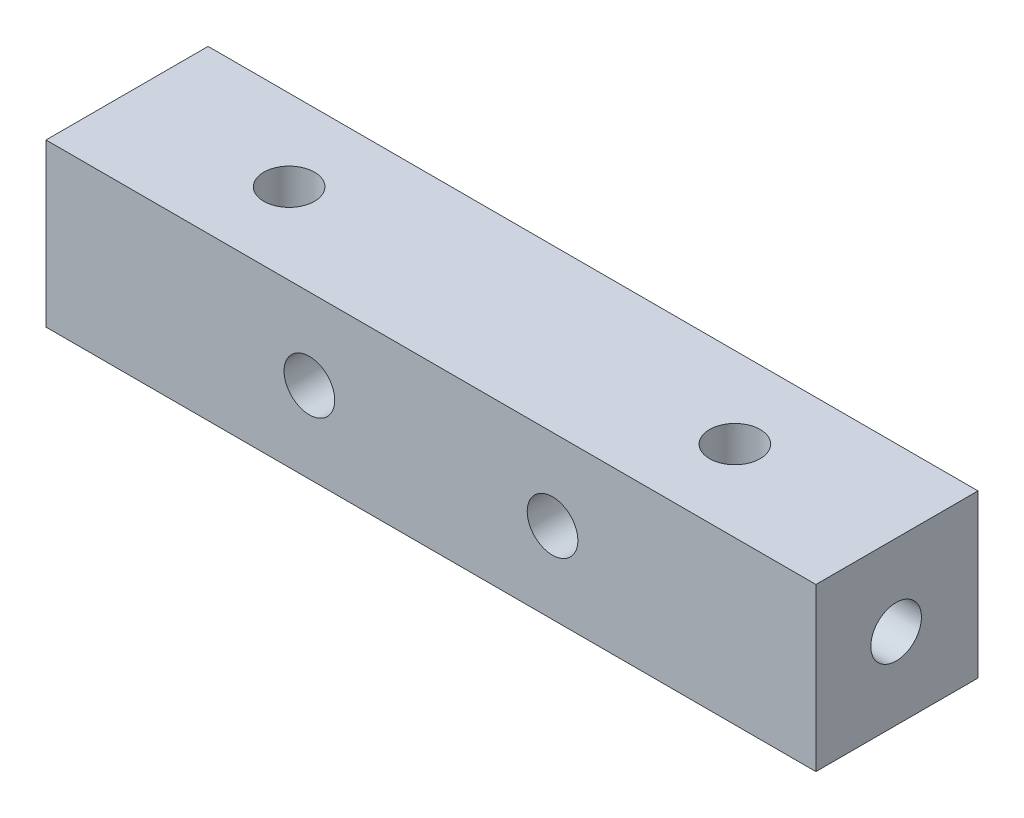
from build123d import *

# Parameters (mm, degrees)
SKETCH_1_W         = 38
SKETCH_1_H         = 8
EXTRUDE_1_DEPTH    = 8
HOLE_WIZARD_M3_1_D = 2.5
HOLE_WIZARD_M3_2_D = 2.5
HOLE_WIZARD_M3_3_D = 2.5
HOLE_WIZARD_M3_4_D = 2.5
HOLE_WIZARD_M3_5_D = 2.5


with BuildPart() as part:
    # 草图1 → 凸台-拉伸1 (new body)
    with BuildSketch(Plane.XY):
        Rectangle(SKETCH_1_W, SKETCH_1_H)
    extrude(amount=EXTRUDE_1_DEPTH)

    # M3 螺纹孔的螺纹孔钻头1 (through all)
    with Locations(Plane(origin=(-19, 0, 4.041163571), x_dir=(0, 0, -1), z_dir=(-1, 0, 0))):
        with Locations((0, 0)):
            Hole(HOLE_WIZARD_M3_1_D / 2)

    # M3 螺纹孔的螺纹孔钻头2 (through all)
    with Locations(Plane(origin=(-11, 4, 4), x_dir=(1, 0, 0), z_dir=(0, 1, 0))):
        with Locations((0, 0)):
            Hole(HOLE_WIZARD_M3_2_D / 2)

    # M3 螺纹孔的螺纹孔钻头3 (through all)
    with Locations(Plane(origin=(11, 4, 4), x_dir=(1, 0, 0), z_dir=(0, 1, 0))):
        with Locations((0, 0)):
            Hole(HOLE_WIZARD_M3_3_D / 2)

    # M3 螺纹孔的螺纹孔钻头4 (through all)
    with Locations(Plane(origin=(-6, 0, 0), x_dir=(-1, 0, 0), z_dir=(0, 0, -1))):
        with Locations((0, 0)):
            Hole(HOLE_WIZARD_M3_4_D / 2)

    # M3 螺纹孔的螺纹孔钻头5 (through all)
    with Locations(Plane(origin=(6, 0, 0), x_dir=(-1, 0, 0), z_dir=(0, 0, -1))):
        with Locations((0, 0)):
            Hole(HOLE_WIZARD_M3_5_D / 2)


solid = part.part
